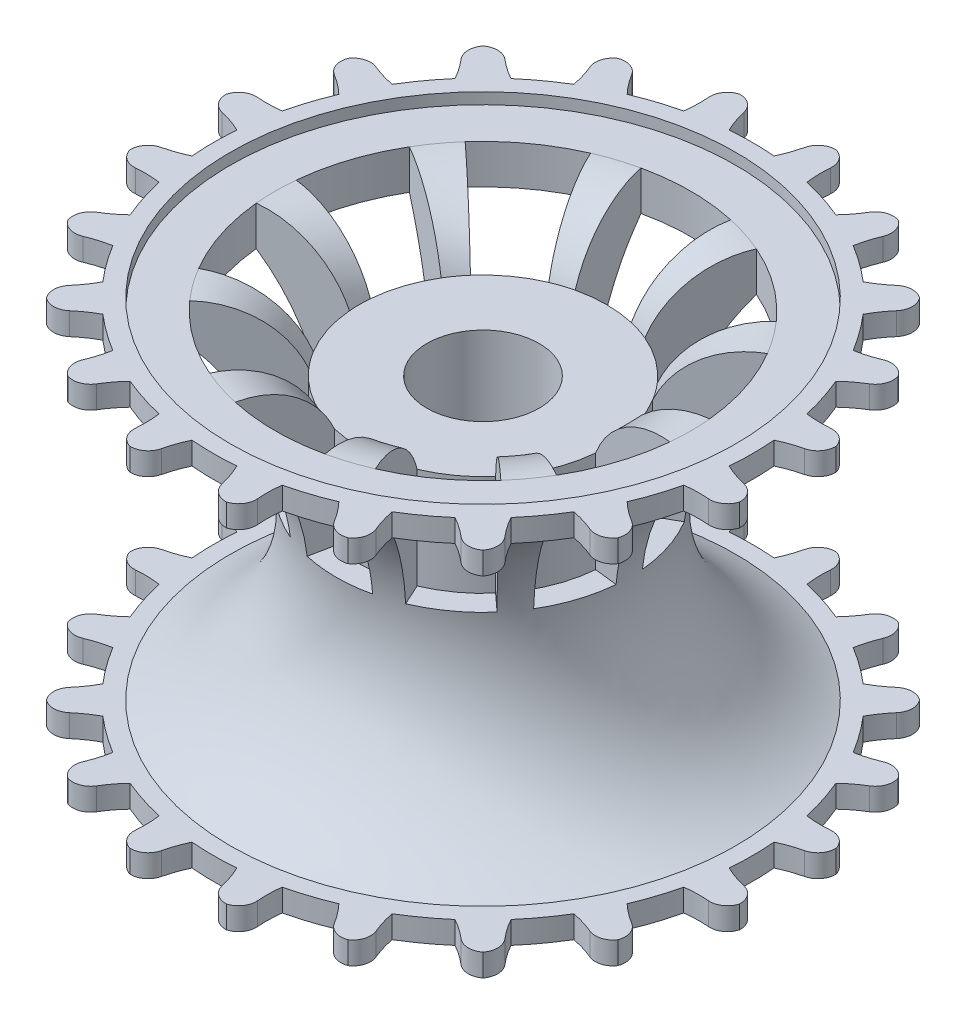
from build123d import *

# Parameters (mm, degrees)
CUT_EXTRUDE_1_DEPTH      = 15
PATTERN_CIRCULAR_1_COUNT = 10
CUT_EXTRUDE_START        = -60
CUT_EXTRUDE_2_DEPTH      = 60
PATTERN_CIRCULAR_2_COUNT = 20
EXTRUDE_START            = -10
EXTRUDE_1_DEPTH          = 8


with BuildPart() as part:
    # 草图1 → 旋转1 (revolve)
    with BuildSketch(Plane.XY, mode=Mode.PRIVATE) as revolve_1_sk:
        with BuildLine():
            Line((5, 0), (11, 0))
            ThreePointArc((11, 0), (13.993060906, 3.635408641), (18.5, 5))
            Line((18.5, 5), (22.5, 5))
            Line((22.5, 5), (22.5, 6))
            Line((22.5, 6), (27.5, 6))
            Line((27.5, 6), (27.5, 4))
            Line((27.5, 4), (22.5, 4))
            ThreePointArc((22.5, 4), (13, -10.5), (22.5, -25))
            Line((22.5, -25), (27.5, -25))
            Line((27.5, -25), (27.5, -27))
            Line((27.5, -27), (22.5, -27))
            ThreePointArc((22.5, -27), (16.312852495, -23.187147505), (12.5, -17))
            Line((12.5, -17), (10, -17))
            Line((10, -17), (10, -19))
            Line((10, -19), (6, -19))
            Line((6, -19), (6, -27))
            Line((6, -27), (4, -27))
            Line((4, -27), (4, -19))
            Line((4, -19), (2, -19))
            Line((2, -19), (2, -14))
            Line((2, -14), (5, -14))
            Line((5, -14), (5, 0))
        make_face()
    revolve(revolve_1_sk.sketch.rotate(Axis((0, 0, 0), (0, -1, 0)), 90), axis=Axis((0, 0, 0), (0, -1, 0)))

    # 草图2 → 切除-拉伸1 (cut)
    with BuildSketch(Plane(origin=(0, 6, 0), x_dir=(1, 0, 0), z_dir=(0, 1, 0))):
        with BuildLine():
            Line((-4, 18.062391868), (-2.5, 10.712142643))
            ThreePointArc((-2.5, 10.712142643), (0, 11), (2.5, 10.712142643))
            Line((2.5, 10.712142643), (4, 18.062391868))
            ThreePointArc((4, 18.062391868), (0, 18.5), (-4, 18.062391868))
        make_face()
    cut_extrude_1 = extrude(amount=-CUT_EXTRUDE_1_DEPTH, mode=Mode.SUBTRACT)

    # 阵列(圆周)1: 切除-拉伸1 ×10 about axis
    pattern_circular_1_axis = Axis((0, 0, 0), (0, 1, 0))
    for i in range(1, PATTERN_CIRCULAR_1_COUNT):
        add(cut_extrude_1.rotate(pattern_circular_1_axis, i * 360 / PATTERN_CIRCULAR_1_COUNT), mode=Mode.SUBTRACT)

    # 草图3 → 切除-拉伸2 (cut)
    with BuildSketch(Plane(origin=(0, 6, 0), x_dir=(1, 0, 0), z_dir=(0, 1, 0)).offset(CUT_EXTRUDE_START)):
        with BuildLine():
            ThreePointArc((2, 23.916521486), (0, 24), (-2, 23.916521486))
            ThreePointArc((-2, 23.916521486), (-2.408936677, 24.90531967), (-2.708038426, 25.932689709))
            ThreePointArc((-2.708038426, 25.932689709), (-3.367418735, 26.885315581), (-4.5, 27.129319933))
            ThreePointArc((-4.5, 27.129319933), (0, 27.5), (4.5, 27.129319933))
            ThreePointArc((4.5, 27.129319933), (3.367418735, 26.885315581), (2.708038426, 25.932689709))
            ThreePointArc((2.708038426, 25.932689709), (2.408936677, 24.90531967), (2, 23.916521486))
        make_face()
    cut_extrude_2 = extrude(amount=CUT_EXTRUDE_2_DEPTH, mode=Mode.SUBTRACT)

    # 阵列(圆周)2: 切除-拉伸2 ×20 about axis
    pattern_circular_2_axis = Axis((0, 0, 0), (0, 1, 0))
    for i in range(1, PATTERN_CIRCULAR_2_COUNT):
        add(cut_extrude_2.rotate(pattern_circular_2_axis, i * 360 / PATTERN_CIRCULAR_2_COUNT), mode=Mode.SUBTRACT)

    # 草图4 → 凸台-拉伸1 (add)
    with BuildSketch(Plane.XZ.offset(27).offset(EXTRUDE_START)):
        with BuildLine():
            Line((-3, -2.645751311), (3, -2.645751311))
            ThreePointArc((3, -2.645751311), (0, -4), (-3, -2.645751311))
        make_face()
    extrude(amount=EXTRUDE_1_DEPTH)


solid = part.part
